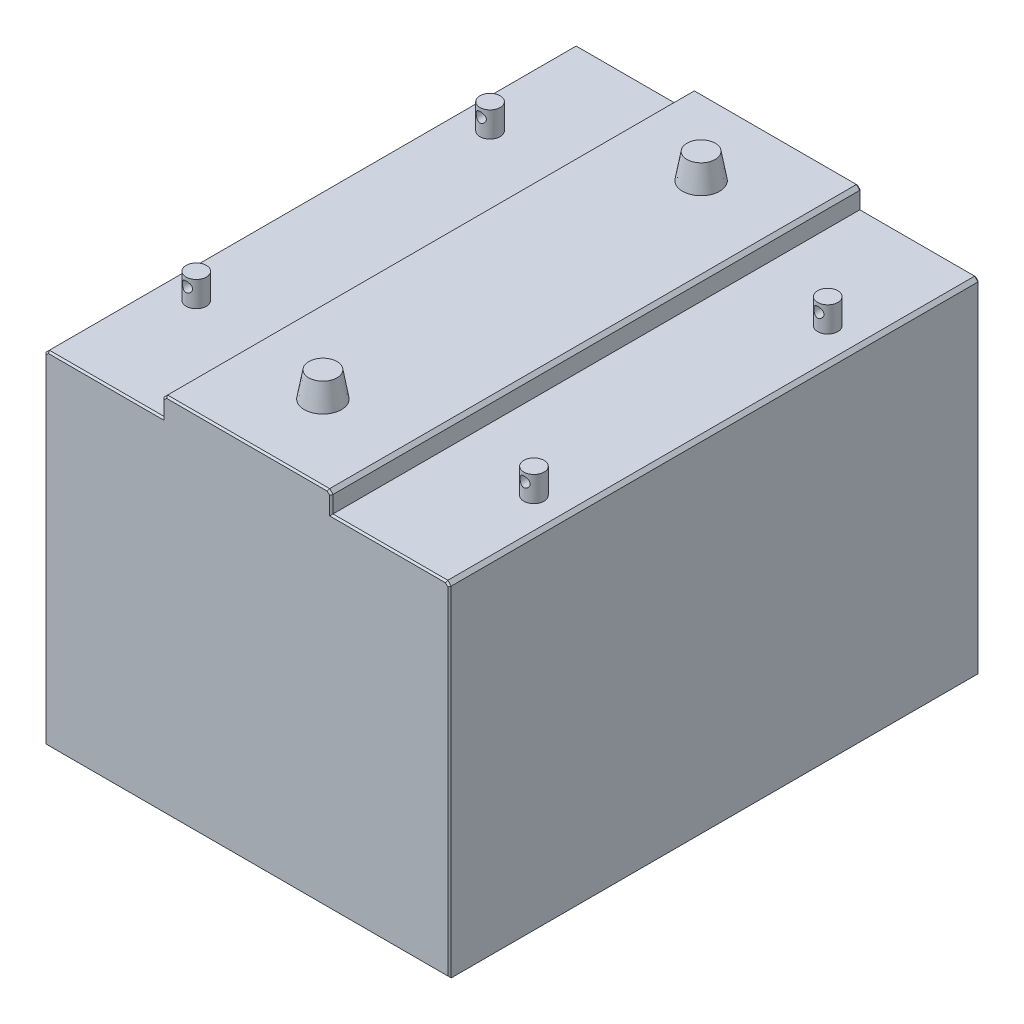
from build123d import *

# Parameters (mm, degrees)
SKETCH_1_W                = 240
SKETCH_1_H                = 215
EXTRUDE_1_DEPTH           = 314
SKETCH_2_W                = 93.930111424
SKETCH_2_H                = 33.454560233
SKETCH_2_W_2              = 70
SKETCH_2_H_2              = 30.443707166
CUT_EXTRUDE_1_DEPTH       = 353.91960841
CHAMFER_1_SIZE            = 2
SKETCH_3_R                = 6
EXTRUDE_2_DEPTH           = 15
SKETCH_4_R                = 3
CUT_EXTRUDE_2_DEPTH       = 354.844951921
SKETCH_5_R                = 11
EXTRUDE_3_DEPTH           = 15
EXTRUDE_3_DRAFT           = 10
EXTRUDE_3_PROFILE_2_DEPTH = 15
EXTRUDE_3_PROFILE_2_DRAFT = 10
CHAMFER_2_SIZE            = 1


with BuildPart() as part:
    # 草图1 → 凸台-拉伸1 (new body)
    with BuildSketch(Plane.XY):
        Rectangle(SKETCH_1_W, SKETCH_1_H)
    extrude(amount=EXTRUDE_1_DEPTH)

    # 草图2 → 切除-拉伸1 (cut, through all)
    with BuildSketch(Plane.XY.offset(314)):
        with Locations((-96.965055712, 112.227280116)):
            Rectangle(SKETCH_2_W, SKETCH_2_H)
        with Locations((85, 110.721853583)):
            Rectangle(SKETCH_2_W_2, SKETCH_2_H_2)
    extrude(amount=-CUT_EXTRUDE_1_DEPTH, mode=Mode.SUBTRACT)

    # 倒角1
    chamfer_1_edges = [part.edges().sort_by_distance(p)[0] for p in [
        (-50, 107.5, 157),
        (-120, 95.5, 157),
        (50, 107.5, 157),
        (120, 95.5, 157),
    ]]
    chamfer(chamfer_1_edges, length=CHAMFER_1_SIZE)

    # 草图3 → 凸台-拉伸2 (add)
    with BuildSketch(Plane(origin=(0, 95.5, 0), x_dir=(1, 0, 0), z_dir=(0, 1, 0))):
        with Locations(Location((-100, -70, 0), (0, 0, 90))):
            Circle(SKETCH_3_R)
        with Locations(Location((-100, -244, 0), (0, 0, 90))):
            Circle(SKETCH_3_R)
    extrude_2 = extrude(amount=EXTRUDE_2_DEPTH)

    # 草图4 → 切除-拉伸2 (cut, through all)
    with BuildSketch(Plane.XY.offset(314)):
        with Locations((-100, 105.5)):
            Circle(SKETCH_4_R)
    cut_extrude_2 = extrude(amount=-CUT_EXTRUDE_2_DEPTH, mode=Mode.SUBTRACT)


with BuildPart() as extrude_3_tool:
    # 草图5 → 凸台-拉伸3 (with draft: the straight prism first)
    with BuildSketch(Plane(origin=(0, 107.5, 0), x_dir=(1, 0, 0), z_dir=(0, 1, 0))):
        with Locations((0, -45)):
            Circle(SKETCH_5_R)
    extrude(amount=EXTRUDE_3_DEPTH)
    # 凸台-拉伸3: the draft: its side faces are tilted about the plane it starts from
    extrude_3_sides = [extrude_3_tool.faces().sort_by_distance(p)[0] for p in [
        (-11, 115, 45),
    ]]
    draft(extrude_3_sides, Plane(origin=(0, 107.5, 0), x_dir=(1, 0, 0), z_dir=(0, 1, 0)), EXTRUDE_3_DRAFT)


with BuildPart() as part_1:
    add(part.part)

    # 凸台-拉伸3: add extrude_3_tool
    add(extrude_3_tool.part)


with BuildPart() as extrude_3_profile_2_tool:
    # 草图5 → 凸台-拉伸3 profile 2 (with draft: the straight prism first)
    with BuildSketch(Plane(origin=(0, 107.5, 0), x_dir=(1, 0, 0), z_dir=(0, 1, 0))):
        with Locations((0, -269)):
            Circle(SKETCH_5_R)
    extrude(amount=EXTRUDE_3_PROFILE_2_DEPTH)
    # 凸台-拉伸3 profile 2: the draft: its side faces are tilted about the plane it starts from
    extrude_3_profile_2_sides = [extrude_3_profile_2_tool.faces().sort_by_distance(p)[0] for p in [
        (-11, 115, 269),
    ]]
    draft(extrude_3_profile_2_sides, Plane(origin=(0, 107.5, 0), x_dir=(1, 0, 0), z_dir=(0, 1, 0)), EXTRUDE_3_PROFILE_2_DRAFT)


with BuildPart() as part_2:
    add(part_1.part)

    # 凸台-拉伸3 profile 2: add extrude_3_profile_2_tool
    add(extrude_3_profile_2_tool.part)

    # 镜向1: 凸台-拉伸2, 切除-拉伸2 across plane
    add(extrude_2.mirror(Plane(origin=(0, 0, 0), x_dir=(0, 0, 1), z_dir=(1, 0, 0))))
    add(cut_extrude_2.mirror(Plane(origin=(0, 0, 0), x_dir=(0, 0, 1), z_dir=(1, 0, 0))), mode=Mode.SUBTRACT)

    # 倒角2
    chamfer_2_edges = [part_2.edges().sort_by_distance(p)[0] for p in [
        (0, -107.5, 314),
        (-84, 95.5, 0),
        (-50, 100.5, 314),
        (-50, 100.5, 0),
        (50, 100.5, 0),
        (84, 95.5, 314),
        (84, 95.5, 0),
        (120, -7, 314),
        (0, -107.5, 0),
        (-120, -7, 314),
        (-120, -7, 0),
        (0, 107.5, 0),
        (-49, 106.5, 0),
        (49, 106.5, 0),
        (119, 94.5, 0),
        (-119, 94.5, 0),
        (-84, 95.5, 314),
        (120, -7, 0),
        (50, 100.5, 314),
        (0, 107.5, 314),
        (-49, 106.5, 314),
        (49, 106.5, 314),
        (119, 94.5, 314),
        (-119, 94.5, 314),
    ]]
    chamfer(chamfer_2_edges, length=CHAMFER_2_SIZE)


solid = part_2.part
